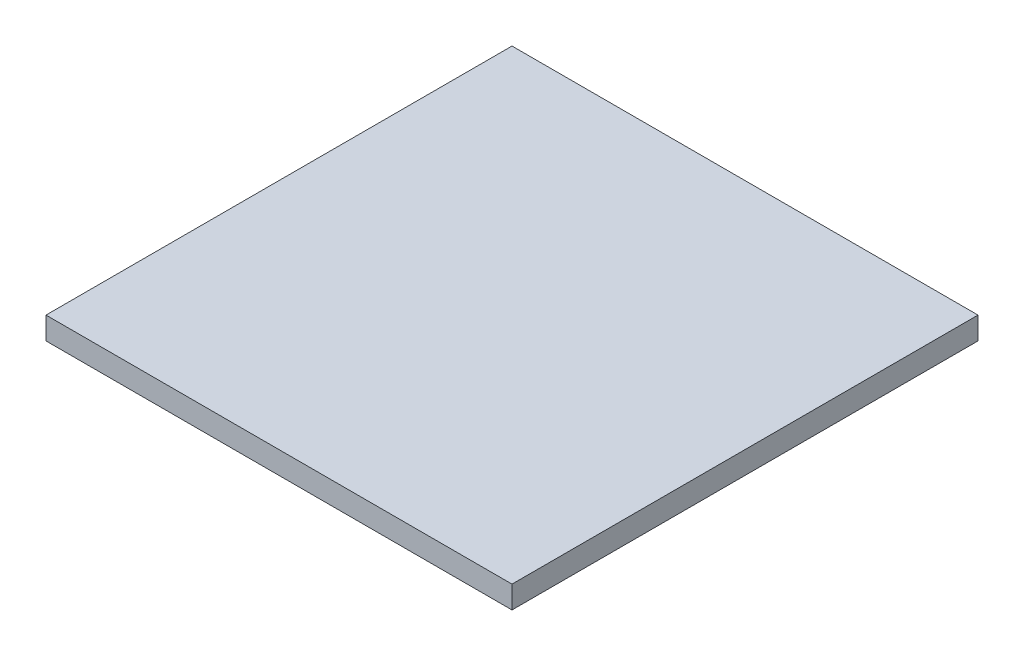
from build123d import *

# Parameters (mm, degrees)
SKETCH1_W           = 104
SKETCH1_H           = 104
BOSS_EXTRUDE1_DEPTH = 5


with BuildPart() as part:
    # Sketch1 → Boss-Extrude1 (new body)
    with BuildSketch(Plane(origin=(0, 0, 0), x_dir=(1, 0, 0), z_dir=(0, 1, 0))):
        with Locations((52, 52)):
            Rectangle(SKETCH1_W, SKETCH1_H)
    extrude(amount=BOSS_EXTRUDE1_DEPTH)


solid = part.part
